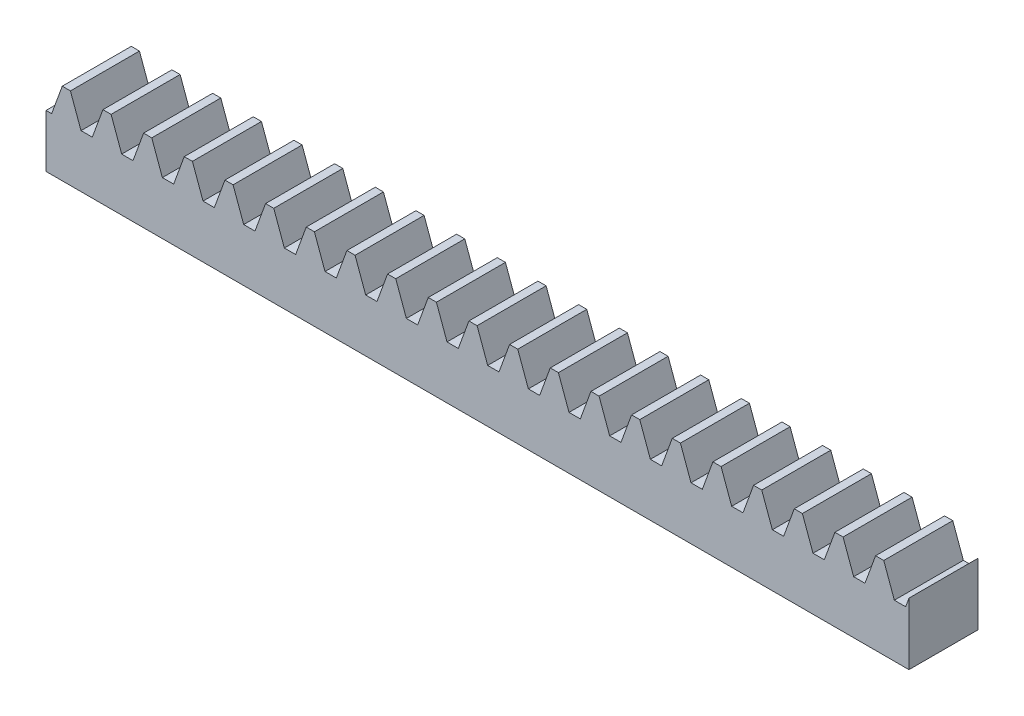
from build123d import *

# Parameters (mm, degrees)
BLANKSKE_W        = 100
BLANKSKE_H        = 9.5
BLANK_DEPTH       = 8
TOOTHCUTSIM_DEPTH = 101.768298586
TEETHCUTS_COUNT   = 22
TEETHCUTS_PITCH   = 4.712388975


with BuildPart() as part:
    # BlankSke → Blank (new body)
    with BuildSketch(Plane.XY):
        with Locations((50, 4.75)):
            Rectangle(BLANKSKE_W, BLANKSKE_H)
    extrude(amount=-BLANK_DEPTH)

    # TooCutSkeSim → ToothCutSim (cut, through all)
    with BuildSketch(Plane.XY):
        Polygon((0.654653055, 6.125), (-0.654653055, 6.125), (-1.892297439, 9.5254), (1.892297439, 9.5254), align=None)
    toothcutsim = extrude(amount=-TOOTHCUTSIM_DEPTH, mode=Mode.SUBTRACT)

    # TeethCuts: ToothCutSim ×22
    with Locations(*[(i * TEETHCUTS_PITCH, 0, 0) for i in range(1, TEETHCUTS_COUNT)]):
        add(toothcutsim, mode=Mode.SUBTRACT)


solid = part.part
